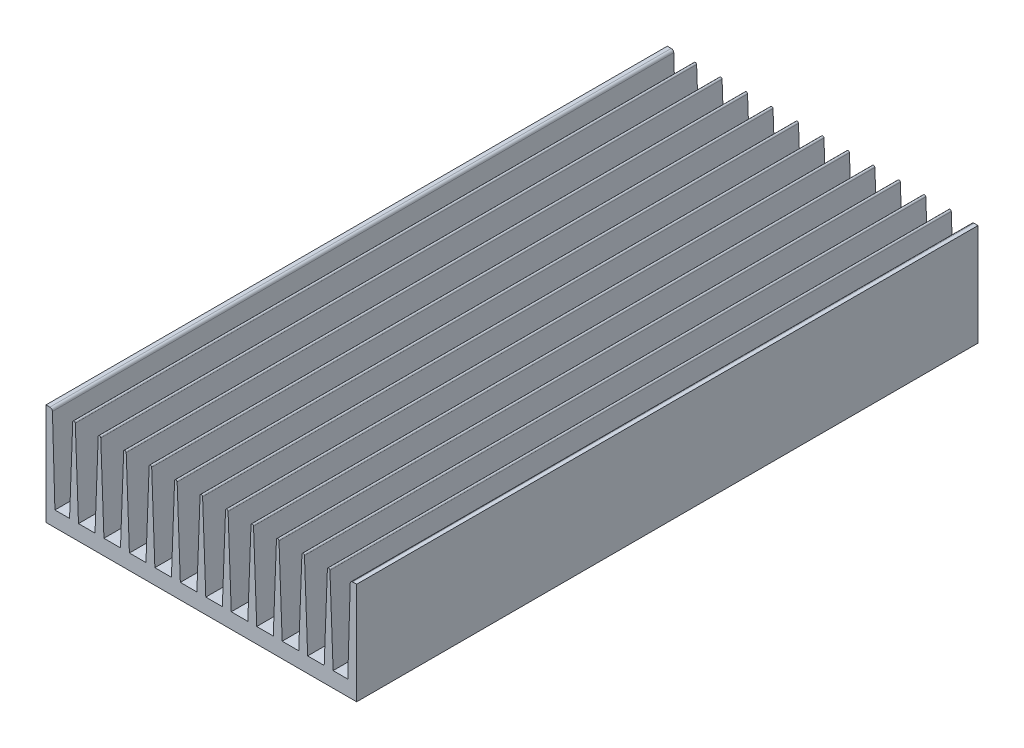
from build123d import *

# Parameters (mm, degrees)
EXTRUDE_1_DEPTH       = 244
EXTRUDE_3_DEPTH       = 244
PATTERN_CURVE_1_COUNT = 11
PATTERN_CURVE_1_PITCH = 10
SKETCH_3_R            = 2.25
CUT_EXTRUDE_1_DEPTH   = 6
SKETCH_4_R            = 1.6
CUT_EXTRUDE_2_DEPTH   = 6


with BuildPart() as part:
    # Эскиз1 → Вытянуть1 (new body)
    with BuildSketch(Plane.XY):
        with BuildLine():
            Line((0, 40), (1.528979332, 40))
            ThreePointArc((1.528979332, 40), (2.225614441, 39.717425624), (2.528547087, 39.029399052))
            Line((2.528547087, 39.029399052), (3.5, 6))
            Line((3.5, 6), (118.5, 6))
            Line((118.5, 6), (119.471452913, 39.029399052))
            ThreePointArc((119.471452913, 39.029399052), (119.774385559, 39.717425624), (120.471020668, 40))
            Line((120.471020668, 40), (122, 40))
            Line((122, 40), (122, 0))
            Line((122, 0), (0, 0))
            Line((0, 0), (0, 40))
        make_face()
    extrude(amount=EXTRUDE_1_DEPTH)

    # Эскиз2 → Вытянуть3 (add)
    with BuildSketch(Plane.XY.offset(244)):
        with BuildLine():
            Line((10.5, 39.5), (9.25, 6))
            Line((9.25, 6), (12.75, 6))
            Line((12.75, 6), (11.5, 39.5))
            ThreePointArc((11.5, 39.5), (11, 40), (10.5, 39.5))
        make_face()
    extrude_3 = extrude(amount=-EXTRUDE_3_DEPTH)

    # Кривая1: Вытянуть3 ×11
    with Locations(*[(i * PATTERN_CURVE_1_PITCH, 0, 0) for i in range(1, PATTERN_CURVE_1_COUNT)]):
        add(extrude_3)

    # Эскиз3 → Вырез-Вытянуть1 (cut)
    with BuildSketch(Plane.XZ):
        with Locations((26, 236)):
            Circle(SKETCH_3_R)
        with Locations((96, 236)):
            Circle(SKETCH_3_R)
        with Locations(Location((96, 8, 0), (0, 0, 180))):
            Circle(SKETCH_3_R)
        with Locations(Location((26, 8, 0), (0, 0, 180))):
            Circle(SKETCH_3_R)
    extrude(amount=-CUT_EXTRUDE_1_DEPTH, mode=Mode.SUBTRACT)

    # Эскиз4 → Вырез-Вытянуть2 (cut)
    with BuildSketch(Plane(origin=(147.933613103, 0, 237.946321054), x_dir=(-1, 0, 0), z_dir=(0, -1, 0))):
        with Locations(Location((42.433613103, 130.446321054, 0), (0, 0, 180))):
            Circle(SKETCH_4_R)
        with Locations(Location((85.933613103, 217.946321054, 0), (0, 0, 180))):
            Circle(SKETCH_4_R)
        with Locations(Location((85.933613103, 82.946321054, 0), (0, 0, 180))):
            Circle(SKETCH_4_R)
    extrude(amount=-CUT_EXTRUDE_2_DEPTH, mode=Mode.SUBTRACT)


solid = part.part
